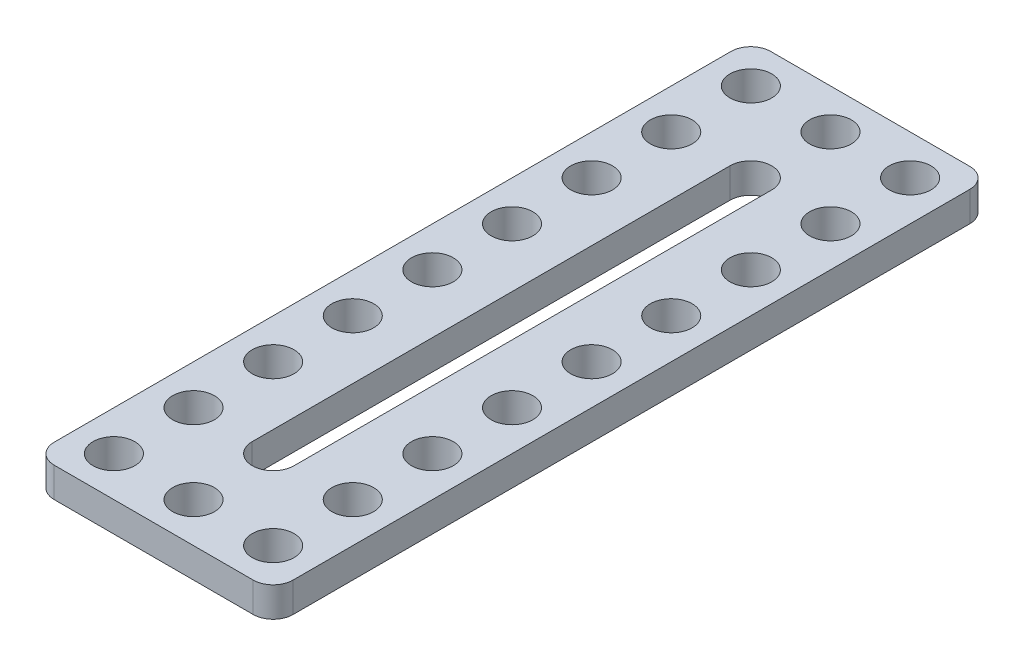
from build123d import *

# Parameters (mm, degrees)
SKETCH_1_W          = 24
SKETCH_1_H          = 72
EXTRUDE_2_DEPTH     = 3
SKETCH_2_R          = 2.1
CUT_EXTRUDE_1_DEPTH = 3
CUT_EXTRUDE_2_DEPTH = 3
FILLET_1_R          = 2


with BuildPart() as part:
    # 草图1 → 凸台-拉伸2 (new body)
    with BuildSketch(Plane(origin=(0, 0, 0), x_dir=(1, 0, 0), z_dir=(0, 1, 0))):
        Rectangle(SKETCH_1_W, SKETCH_1_H)
    extrude(amount=EXTRUDE_2_DEPTH)

    # 草图2 → 切除-拉伸1 (cut)
    with BuildSketch(Plane(origin=(0, 3, 0), x_dir=(1, 0, 0), z_dir=(0, 1, 0))):
        with Locations(Location((-8, -32, 0), (0, 0, 270))):
            Circle(SKETCH_2_R)
        with Locations(Location((-8, -24, 0), (0, 0, 270))):
            Circle(SKETCH_2_R)
        with Locations(Location((-8, -16, 0), (0, 0, 270))):
            Circle(SKETCH_2_R)
        with Locations(Location((-8, -8, 0), (0, 0, 270))):
            Circle(SKETCH_2_R)
        with Locations(Location((-8, 0, 0), (0, 0, 270))):
            Circle(SKETCH_2_R)
        with Locations(Location((-8, 8, 0), (0, 0, 270))):
            Circle(SKETCH_2_R)
        with Locations(Location((-8, 16, 0), (0, 0, 270))):
            Circle(SKETCH_2_R)
        with Locations(Location((-8, 24, 0), (0, 0, 270))):
            Circle(SKETCH_2_R)
        with Locations(Location((-8, 32, 0), (0, 0, 270))):
            Circle(SKETCH_2_R)
        with Locations(Location((8, -24, 0), (0, 0, 90))):
            Circle(SKETCH_2_R)
        with Locations(Location((8, -16, 0), (0, 0, 90))):
            Circle(SKETCH_2_R)
        with Locations(Location((8, -8, 0), (0, 0, 90))):
            Circle(SKETCH_2_R)
        with Locations(Location((8, 0, 0), (0, 0, 90))):
            Circle(SKETCH_2_R)
        with Locations(Location((8, 8, 0), (0, 0, 90))):
            Circle(SKETCH_2_R)
        with Locations(Location((8, 16, 0), (0, 0, 90))):
            Circle(SKETCH_2_R)
        with Locations(Location((8, 24, 0), (0, 0, 90))):
            Circle(SKETCH_2_R)
        with Locations(Location((8, 32, 0), (0, 0, 90))):
            Circle(SKETCH_2_R)
        with Locations(Location((8, -32, 0), (0, 0, 90))):
            Circle(SKETCH_2_R)
        with Locations(Location((0, -32, 0), (0, 0, 90))):
            Circle(SKETCH_2_R)
        with Locations(Location((0, 32, 0), (0, 0, 270))):
            Circle(SKETCH_2_R)
    extrude(amount=-CUT_EXTRUDE_1_DEPTH, mode=Mode.SUBTRACT)

    # 草图3 → 切除-拉伸2 (cut)
    with BuildSketch(Plane(origin=(0, 3, 0), x_dir=(1, 0, 0), z_dir=(0, 1, 0))):
        with BuildLine():
            Line((-2.1, -24), (-2.1, 24))
            ThreePointArc((-2.1, 24), (0, 26.1), (2.1, 24))
            Line((2.1, 24), (2.1, -24))
            ThreePointArc((2.1, -24), (0, -26.1), (-2.1, -24))
        make_face()
    extrude(amount=-CUT_EXTRUDE_2_DEPTH, mode=Mode.SUBTRACT)

    # 圆角1
    fillet_1_edges = [part.edges().sort_by_distance(p)[0] for p in [
        (12, 1.5, 36),
        (-12, 1.5, 36),
        (-12, 1.5, -36),
        (12, 1.5, -36),
    ]]
    fillet(fillet_1_edges, radius=FILLET_1_R)


solid = part.part
